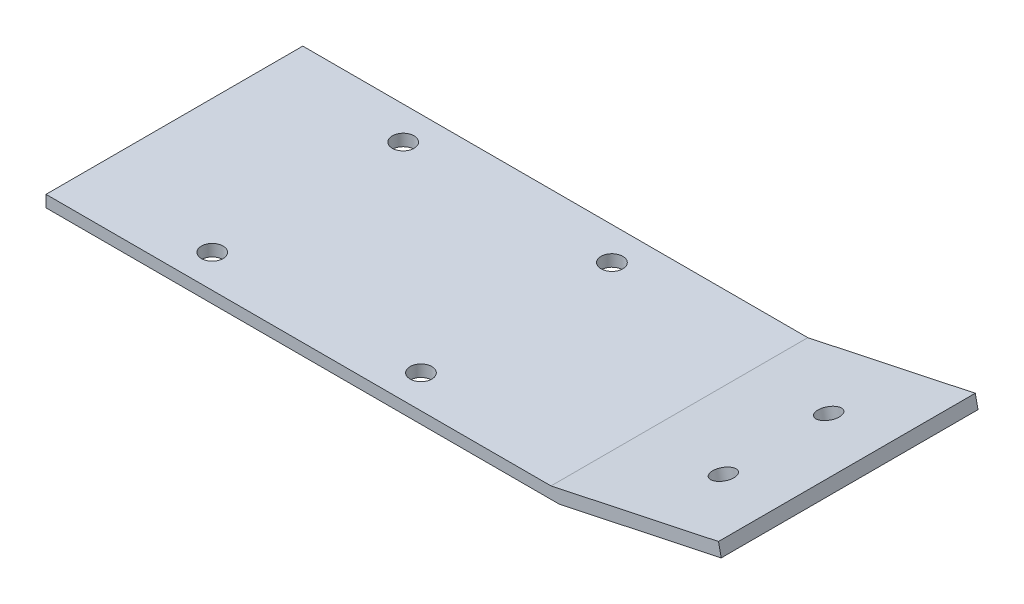
from build123d import *

# Parameters (mm, degrees)
EXTRUDE_1_DEPTH     = 39
SKETCH_3_R          = 1.65
CUT_EXTRUDE_1_DEPTH = 10
SKETCH_4_R          = 1.65
CUT_EXTRUDE_2_DEPTH = 10


with BuildPart() as part:
    # 草图1 → 凸台-拉伸1 (new body)
    with BuildSketch(Plane.XY):
        Polygon((0, 0), (77.940672381, 0), (102.547661001, 5.230376894), (102.131837619, 7.186672096), (76.7, 1.780968134), (0, 1.780968134), align=None)
    extrude(amount=EXTRUDE_1_DEPTH)

    # 草图3 → 切除-拉伸1 (cut)
    with BuildSketch(Plane(origin=(2.953339199, -13.89436852, 0), x_dir=(0.9781476007338052, 0.20791169081776095, 0), z_dir=(-0.20791169081776098, 0.9781476007338054, 0))):
        with Locations(Location((90.394205072, -11.5, 0), (0, 0, 180))):
            Circle(SKETCH_3_R)
        with Locations(Location((90.394205072, -27.5, 0), (0, 0, 180))):
            Circle(SKETCH_3_R)
    extrude(amount=-CUT_EXTRUDE_1_DEPTH, mode=Mode.SUBTRACT)

    # 草图4 → 切除-拉伸2 (cut)
    with BuildSketch(Plane(origin=(0, 1.780968134, 0), x_dir=(1, 0, 0), z_dir=(0, 1, 0))):
        with Locations(Location((20.25, -5, 0), (0, 0, 180))):
            Circle(SKETCH_4_R)
        with Locations(Location((51.95, -5, 0), (0, 0, 180))):
            Circle(SKETCH_4_R)
        with Locations(Location((51.95, -34, 0), (0, 0, 270))):
            Circle(SKETCH_4_R)
        with Locations(Location((20.25, -34, 0), (0, 0, 270))):
            Circle(SKETCH_4_R)
    extrude(amount=-CUT_EXTRUDE_2_DEPTH, mode=Mode.SUBTRACT)


solid = part.part
